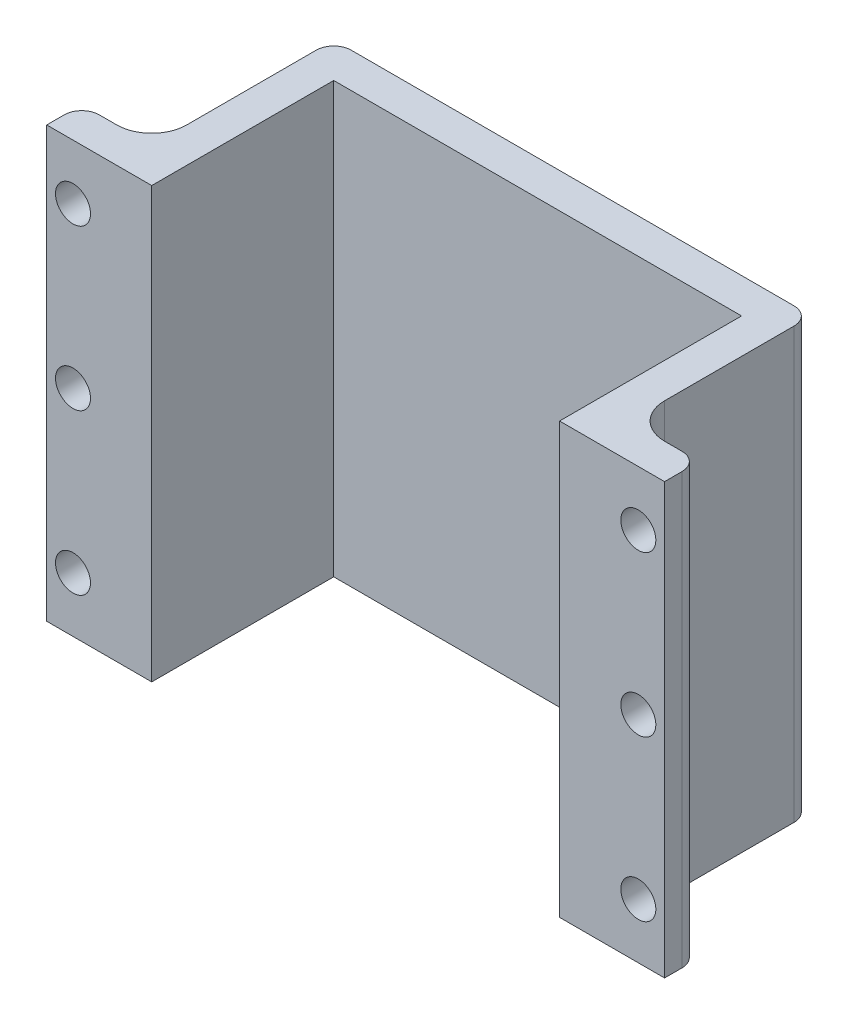
from build123d import *

# Parameters (mm, degrees)
BOSS_EXTRUDE1_DEPTH            = 78
CUT_EXTRUDE1_REACH             = 103.567
SKETCH2_R                      = 3.175
CUT_EXTRUDE1_DIRECTION_2_REACH = 103.567


with BuildPart() as part:
    # Sketch1 → Boss-Extrude1 (new body)
    with BuildSketch(Plane(origin=(0, 0, 0), x_dir=(1, 0, 0), z_dir=(0, 1, 0))):
        with BuildLine():
            Line((-37, -33.02), (-37, 0))
            Line((-37, 0), (37, 0))
            Line((37, 0), (37, -33.02))
            Line((37, -33.02), (56.05, -33.02))
            Line((56.05, -33.02), (56.05, -29.845))
            ThreePointArc((56.05, -29.845), (55.12006403, -27.59993597), (52.875, -26.67))
            Line((52.875, -26.67), (49.7, -26.67))
            ThreePointArc((49.7, -26.67), (45.209871939, -24.810128061), (43.35, -20.32))
            Line((43.35, -20.32), (43.35, 0))
            Line((43.35, 0), (43.35, 3.175))
            ThreePointArc((43.35, 3.175), (42.42006403, 5.42006403), (40.175, 6.35))
            Line((40.175, 6.35), (-40.175, 6.35))
            ThreePointArc((-40.175, 6.35), (-42.42006403, 5.42006403), (-43.35, 3.175))
            Line((-43.35, 3.175), (-43.35, 0))
            Line((-43.35, 0), (-43.35, -20.32))
            ThreePointArc((-43.35, -20.32), (-45.209871939, -24.810128061), (-49.7, -26.67))
            Line((-49.7, -26.67), (-52.875, -26.67))
            ThreePointArc((-52.875, -26.67), (-55.12006403, -27.59993597), (-56.05, -29.845))
            Line((-56.05, -29.845), (-56.05, -33.02))
            Line((-56.05, -33.02), (-37, -33.02))
        make_face()
    extrude(amount=BOSS_EXTRUDE1_DEPTH)

    # Sketch2 → Cut-Extrude1 (cut, up to next)
    with BuildSketch(Plane(origin=(0, 0, 26.67), x_dir=(-1, 0, 0), z_dir=(0, 0, -1)), mode=Mode.PRIVATE) as cut_extrude1_sk1:
        with Locations(Location((-51.2875, 10, 0), (0, 0, 240))):
            Circle(SKETCH2_R)
    cut_extrude1_tool1 = extrude(cut_extrude1_sk1.sketch, amount=-CUT_EXTRUDE1_REACH, mode=Mode.PRIVATE) & part.part
    # Sketch2 → Cut-Extrude1 (cut, up to next)
    with BuildSketch(Plane(origin=(0, 0, 26.67), x_dir=(-1, 0, 0), z_dir=(0, 0, -1)), mode=Mode.PRIVATE) as cut_extrude1_sk2:
        with Locations(Location((-51.2875, 39, 0), (0, 0, 240))):
            Circle(SKETCH2_R)
    cut_extrude1_tool2 = extrude(cut_extrude1_sk2.sketch, amount=-CUT_EXTRUDE1_REACH, mode=Mode.PRIVATE) & part.part
    # Sketch2 → Cut-Extrude1 (cut, up to next)
    with BuildSketch(Plane(origin=(0, 0, 26.67), x_dir=(-1, 0, 0), z_dir=(0, 0, -1)), mode=Mode.PRIVATE) as cut_extrude1_sk3:
        with Locations(Location((-51.2875, 68, 0), (0, 0, 240))):
            Circle(SKETCH2_R)
    cut_extrude1_tool3 = extrude(cut_extrude1_sk3.sketch, amount=-CUT_EXTRUDE1_REACH, mode=Mode.PRIVATE) & part.part
    # Sketch2 → Cut-Extrude1 (cut, up to next)
    with BuildSketch(Plane(origin=(0, 0, 26.67), x_dir=(-1, 0, 0), z_dir=(0, 0, -1)), mode=Mode.PRIVATE) as cut_extrude1_sk4:
        with Locations(Location((51.2875, 68, 0), (0, 0, 180))):
            Circle(SKETCH2_R)
    cut_extrude1_tool4 = extrude(cut_extrude1_sk4.sketch, amount=-CUT_EXTRUDE1_REACH, mode=Mode.PRIVATE) & part.part
    # Sketch2 → Cut-Extrude1 (cut, up to next)
    with BuildSketch(Plane(origin=(0, 0, 26.67), x_dir=(-1, 0, 0), z_dir=(0, 0, -1)), mode=Mode.PRIVATE) as cut_extrude1_sk5:
        with Locations(Location((51.2875, 39, 0), (0, 0, 180))):
            Circle(SKETCH2_R)
    cut_extrude1_tool5 = extrude(cut_extrude1_sk5.sketch, amount=-CUT_EXTRUDE1_REACH, mode=Mode.PRIVATE) & part.part
    # Sketch2 → Cut-Extrude1 (cut, up to next)
    with BuildSketch(Plane(origin=(0, 0, 26.67), x_dir=(-1, 0, 0), z_dir=(0, 0, -1)), mode=Mode.PRIVATE) as cut_extrude1_sk6:
        with Locations(Location((51.2875, 10, 0), (0, 0, 180))):
            Circle(SKETCH2_R)
    cut_extrude1_tool6 = extrude(cut_extrude1_sk6.sketch, amount=-CUT_EXTRUDE1_REACH, mode=Mode.PRIVATE) & part.part
    add(cut_extrude1_tool1.solids().sort_by_distance((51.2875, 10, 26.67))[0], mode=Mode.SUBTRACT)
    add(cut_extrude1_tool2.solids().sort_by_distance((51.2875, 39, 26.67))[0], mode=Mode.SUBTRACT)
    add(cut_extrude1_tool3.solids().sort_by_distance((51.2875, 68, 26.67))[0], mode=Mode.SUBTRACT)
    add(cut_extrude1_tool4.solids().sort_by_distance((-51.2875, 68, 26.67))[0], mode=Mode.SUBTRACT)
    add(cut_extrude1_tool5.solids().sort_by_distance((-51.2875, 39, 26.67))[0], mode=Mode.SUBTRACT)
    add(cut_extrude1_tool6.solids().sort_by_distance((-51.2875, 10, 26.67))[0], mode=Mode.SUBTRACT)

    # Cut-Extrude1 direction 2: up to this face of the body (flat: up to its plane)
    cut_extrude1_direction_2_end = Plane(part.part.faces().sort_by_distance((0, 39, -6.35))[0])
    # Sketch2 → Cut-Extrude1 direction 2 (cut, up to the picked face)
    with BuildSketch(Plane(origin=(0, 0, 26.67), x_dir=(-1, 0, 0), z_dir=(0, 0, -1)), mode=Mode.PRIVATE) as cut_extrude1_direction_2_sk1:
        with Locations(Location((-51.2875, 10, 0), (0, 0, 240))):
            Circle(SKETCH2_R)
    cut_extrude1_direction_2_tool1 = split(extrude(cut_extrude1_direction_2_sk1.sketch, amount=CUT_EXTRUDE1_DIRECTION_2_REACH, mode=Mode.PRIVATE), bisect_by=cut_extrude1_direction_2_end, keep=Keep.BOTH, mode=Mode.PRIVATE)
    # Sketch2 → Cut-Extrude1 direction 2 (cut, up to the picked face)
    with BuildSketch(Plane(origin=(0, 0, 26.67), x_dir=(-1, 0, 0), z_dir=(0, 0, -1)), mode=Mode.PRIVATE) as cut_extrude1_direction_2_sk2:
        with Locations(Location((-51.2875, 39, 0), (0, 0, 240))):
            Circle(SKETCH2_R)
    cut_extrude1_direction_2_tool2 = split(extrude(cut_extrude1_direction_2_sk2.sketch, amount=CUT_EXTRUDE1_DIRECTION_2_REACH, mode=Mode.PRIVATE), bisect_by=cut_extrude1_direction_2_end, keep=Keep.BOTH, mode=Mode.PRIVATE)
    # Sketch2 → Cut-Extrude1 direction 2 (cut, up to the picked face)
    with BuildSketch(Plane(origin=(0, 0, 26.67), x_dir=(-1, 0, 0), z_dir=(0, 0, -1)), mode=Mode.PRIVATE) as cut_extrude1_direction_2_sk3:
        with Locations(Location((-51.2875, 68, 0), (0, 0, 240))):
            Circle(SKETCH2_R)
    cut_extrude1_direction_2_tool3 = split(extrude(cut_extrude1_direction_2_sk3.sketch, amount=CUT_EXTRUDE1_DIRECTION_2_REACH, mode=Mode.PRIVATE), bisect_by=cut_extrude1_direction_2_end, keep=Keep.BOTH, mode=Mode.PRIVATE)
    # Sketch2 → Cut-Extrude1 direction 2 (cut, up to the picked face)
    with BuildSketch(Plane(origin=(0, 0, 26.67), x_dir=(-1, 0, 0), z_dir=(0, 0, -1)), mode=Mode.PRIVATE) as cut_extrude1_direction_2_sk4:
        with Locations(Location((51.2875, 68, 0), (0, 0, 180))):
            Circle(SKETCH2_R)
    cut_extrude1_direction_2_tool4 = split(extrude(cut_extrude1_direction_2_sk4.sketch, amount=CUT_EXTRUDE1_DIRECTION_2_REACH, mode=Mode.PRIVATE), bisect_by=cut_extrude1_direction_2_end, keep=Keep.BOTH, mode=Mode.PRIVATE)
    # Sketch2 → Cut-Extrude1 direction 2 (cut, up to the picked face)
    with BuildSketch(Plane(origin=(0, 0, 26.67), x_dir=(-1, 0, 0), z_dir=(0, 0, -1)), mode=Mode.PRIVATE) as cut_extrude1_direction_2_sk5:
        with Locations(Location((51.2875, 39, 0), (0, 0, 180))):
            Circle(SKETCH2_R)
    cut_extrude1_direction_2_tool5 = split(extrude(cut_extrude1_direction_2_sk5.sketch, amount=CUT_EXTRUDE1_DIRECTION_2_REACH, mode=Mode.PRIVATE), bisect_by=cut_extrude1_direction_2_end, keep=Keep.BOTH, mode=Mode.PRIVATE)
    # Sketch2 → Cut-Extrude1 direction 2 (cut, up to the picked face)
    with BuildSketch(Plane(origin=(0, 0, 26.67), x_dir=(-1, 0, 0), z_dir=(0, 0, -1)), mode=Mode.PRIVATE) as cut_extrude1_direction_2_sk6:
        with Locations(Location((51.2875, 10, 0), (0, 0, 180))):
            Circle(SKETCH2_R)
    cut_extrude1_direction_2_tool6 = split(extrude(cut_extrude1_direction_2_sk6.sketch, amount=CUT_EXTRUDE1_DIRECTION_2_REACH, mode=Mode.PRIVATE), bisect_by=cut_extrude1_direction_2_end, keep=Keep.BOTH, mode=Mode.PRIVATE)
    add(cut_extrude1_direction_2_tool1.solids().sort_by(Axis((51.2875, 10, 26.67), (0, 0, -1)))[0], mode=Mode.SUBTRACT)
    add(cut_extrude1_direction_2_tool2.solids().sort_by(Axis((51.2875, 39, 26.67), (0, 0, -1)))[0], mode=Mode.SUBTRACT)
    add(cut_extrude1_direction_2_tool3.solids().sort_by(Axis((51.2875, 68, 26.67), (0, 0, -1)))[0], mode=Mode.SUBTRACT)
    add(cut_extrude1_direction_2_tool4.solids().sort_by(Axis((-51.2875, 68, 26.67), (0, 0, -1)))[0], mode=Mode.SUBTRACT)
    add(cut_extrude1_direction_2_tool5.solids().sort_by(Axis((-51.2875, 39, 26.67), (0, 0, -1)))[0], mode=Mode.SUBTRACT)
    add(cut_extrude1_direction_2_tool6.solids().sort_by(Axis((-51.2875, 10, 26.67), (0, 0, -1)))[0], mode=Mode.SUBTRACT)


solid = part.part
